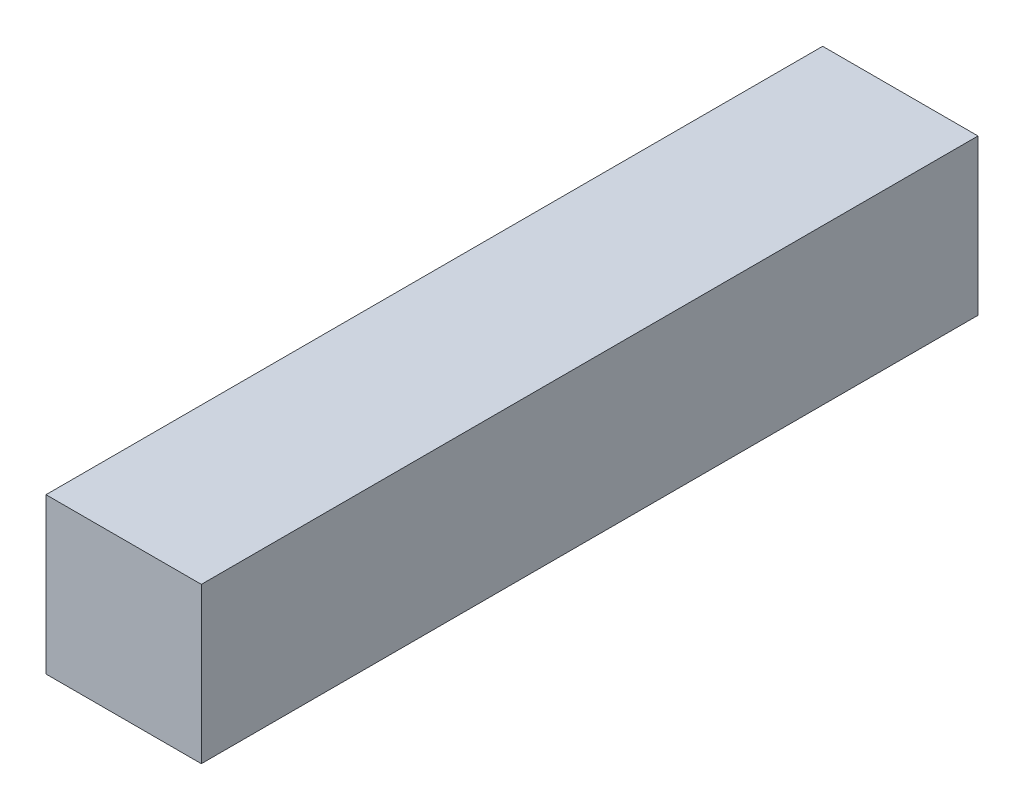
from build123d import *

# Parameters (mm, degrees)
SKETCH_1_W      = 2000
SKETCH_1_H      = 2000
EXTRUDE_1_DEPTH = 10000


with BuildPart() as part:
    # ｽｹｯﾁ1 → ﾎﾞｽ - 押し出し1 (new body)
    with BuildSketch(Plane.XY):
        Rectangle(SKETCH_1_W, SKETCH_1_H)
    extrude(amount=EXTRUDE_1_DEPTH)


solid = part.part
